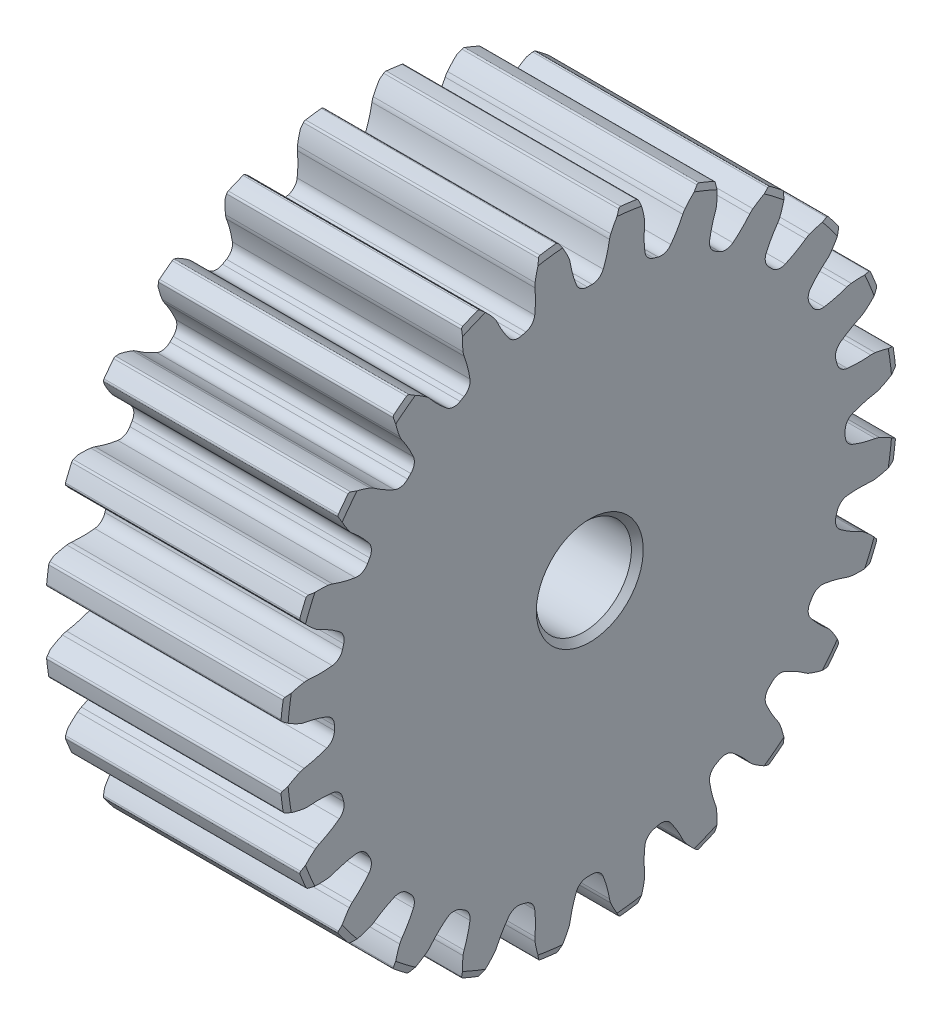
from build123d import *

# Parameters (mm, degrees)
CHAMFER1_SIZE      = 0.5
CUT_EXTRUDE1_DEPTH = 42.856899073
CIRPATTERN1_COUNT  = 24


with BuildPart() as part:
    # Sketch1 → Revolve1 (revolve)
    with BuildSketch(Plane.XY):
        Polygon((0, 4), (0, 25.5), (0.133974596, 26), (19.866025404, 26), (20, 25.5), (20, 4), align=None)
    revolve(axis=Axis((0, 0, 0), (1, 0, 0)))

    # Chamfer1
    chamfer1_edges = [part.edges().sort_by_distance(p)[0] for p in [
        (20, -4, 0),
        (0, -4, 0),
    ]]
    chamfer(chamfer1_edges, length=CHAMFER1_SIZE)

    # Sketch2 → Cut-Extrude1 (cut, through all)
    with BuildSketch(Plane(origin=(0, 0, 0), x_dir=(0, 0, -1), z_dir=(1, 0, 0))):
        with BuildLine():
            ThreePointArc((1.133185542, 22.134623412), (1.446225178, 23.074736107), (1.66069322, 24.042108399))
            ThreePointArc((1.66069322, 24.042108399), (1.702592196, 24.222241996), (1.766446504, 24.395811188))
            ThreePointArc((1.766446504, 24.395811188), (2.120562769, 25.103435861), (2.542852722, 25.772616107))
            ThreePointArc((2.542852722, 25.772616107), (2.623741801, 25.839718818), (2.727485521, 25.856543132))
            ThreePointArc((2.727485521, 25.856543132), (0, 26), (-2.727485521, 25.856543132))
            ThreePointArc((-2.727485521, 25.856543132), (-2.623741801, 25.839718818), (-2.542852722, 25.772616107))
            ThreePointArc((-2.542852722, 25.772616107), (-2.120562769, 25.103435861), (-1.766446504, 24.395811188))
            ThreePointArc((-1.766446504, 24.395811188), (-1.702592196, 24.222241996), (-1.66069322, 24.042108399))
            ThreePointArc((-1.66069322, 24.042108399), (-1.446225178, 23.074736107), (-1.133185542, 22.134623412))
            ThreePointArc((-1.133185542, 22.134623412), (-0.761964008, 21.670596535), (-0.192993979, 21.499133781))
            ThreePointArc((-0.192993979, 21.499133781), (0, 21.5), (0.192993979, 21.499133781))
            ThreePointArc((0.192993979, 21.499133781), (0.761964008, 21.670596535), (1.133185542, 22.134623412))
        make_face()
    cut_extrude1 = extrude(amount=CUT_EXTRUDE1_DEPTH, mode=Mode.SUBTRACT)

    # CirPattern1: Cut-Extrude1 ×24 about axis
    cirpattern1_axis = Axis((0, 0, 0), (-1, 0, 0))
    for i in range(1, CIRPATTERN1_COUNT):
        add(cut_extrude1.rotate(cirpattern1_axis, i * 360 / CIRPATTERN1_COUNT), mode=Mode.SUBTRACT)


solid = part.part
